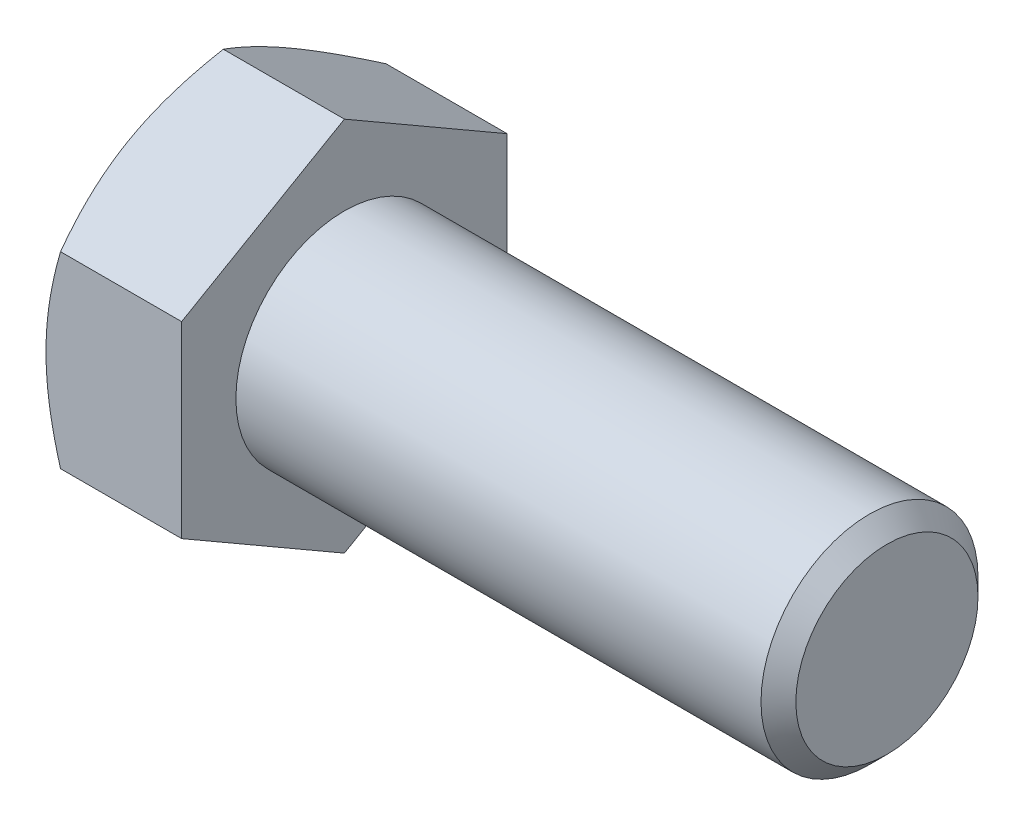
from build123d import *

# Parameters (mm, degrees)
BASEHEAD_DEPTH = 7.5


with BuildPart() as part:
    # Sketch1 → BaseHead (new body)
    with BuildSketch(Plane(origin=(0, 0, 0), x_dir=(0, 0, -1), z_dir=(1, 0, 0))):
        Polygon((9, 5.196152423), (9, -5.196152423), (0, -10.392304845), (-9, -5.196152423), (-9, 5.196152423), (0, 10.392304845), align=None)
    extrude(amount=BASEHEAD_DEPTH)

    # BodySke → BaseBody (revolve)
    with BuildSketch(Plane.XY, mode=Mode.PRIVATE) as basebody_sk:
        Polygon((0, 0), (37.5, 0), (37.5, 5.036), (36.536, 6), (0, 6), align=None)
    revolve(basebody_sk.sketch.rotate(Axis((0, 0, 0), (1, 0, 0)), 90), axis=Axis((0, 0, 0), (1, 0, 0)))

    # Sketch3 → HeadChamfer (revolve, cut)
    with BuildSketch(Plane.XY):
        Polygon((0, 9), (3.690598923, 15.392304845), (3.690598923, 20.392304845), (-10, 20.392304845), (-10, 9), align=None)
    revolve(axis=Axis((0, 0, 0), (1, 0, 0)), mode=Mode.SUBTRACT)


solid = part.part
